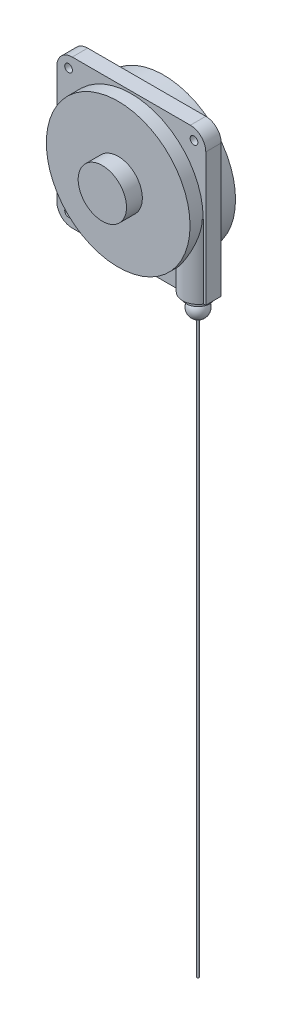
from build123d import *

# Parameters (mm, degrees)
SZKIC1_W                    = 193
SZKIC1_H                    = 192
DODANIE_WYCI_GNI_CIE1_DEPTH = 47.5
OTW_R_10_0_10_1_D           = 10
SZKIC5_R                    = 20
DODANIE_WYCI_GNI_CIE2_DEPTH = 95
ZAOKR_GLENIE1_R             = 20


with BuildPart() as part:
    # Szkic1 → Dodanie-wyciągnięcie1 (new, symmetric)
    with BuildSketch(Plane.XY):
        Rectangle(SZKIC1_W, SZKIC1_H)
    extrude(amount=DODANIE_WYCI_GNI_CIE1_DEPTH, both=True)

    # Szkic2 → Wycięcie-obrót1 (revolve, cut)
    with BuildSketch(Plane(origin=(0, 0, 0), x_dir=(1, 0, 0), z_dir=(0, 1, 0))):
        Polygon((-93.108465818, -10), (-93.108465818, -26.965533902), (-31.305449461, -26.965533902), (-31.305449461, -47.5), (-96.5, -47.5), (-149.784754378, -47.5), (-149.784754378, -10), align=None)
        Polygon((-93.108465818, 10), (-149.784754378, 10), (-149.784754378, 64.69075005), (-34.374339346, 64.69075005), (-34.374339346, 47.5), (-93.108465818, 31.958776917), align=None)
    revolve(axis=Axis((0, 0, 0), (0, 0, -1)), mode=Mode.SUBTRACT)

    # Otwór Ø10.0 (10)1 (through all)
    with Locations(Plane.XY.offset(10)):
        with Locations((-81.25, 81.25), (81.25, 81.25), (-81.25, -81.25)):
            Hole(OTW_R_10_0_10_1_D / 2)

    # Szkic5 → Dodanie-wyciągnięcie2 (add)
    with BuildSketch(Plane.XZ.offset(96)):
        with Locations((76.5, 0)):
            Circle(SZKIC5_R)
    extrude(amount=-DODANIE_WYCI_GNI_CIE2_DEPTH)

    # Zaokrąglenie1
    zaokr_glenie1_edges = [part.edges().sort_by_distance(p)[0] for p in [
        (-96.5, -96, 0),
        (-96.5, 96, 0),
        (96.5, 96, 0),
    ]]
    fillet(zaokr_glenie1_edges, radius=ZAOKR_GLENIE1_R)

    # Szkic6 → Obrót1 (revolve)
    with BuildSketch(Plane.XY):
        with BuildLine():
            Line((76.5, -96), (91.5, -96))
            Line((91.5, -96), (91.5, -102))
            Line((91.5, -102), (81.295831523, -102))
            ThreePointArc((81.295831523, -102), (88.377677323, -114.709029376), (78, -124.9058809))
            Line((78, -124.9058809), (78, -864.813984477))
            Line((78, -864.813984477), (76.5, -864.813984477))
            Line((76.5, -864.813984477), (76.5, -96))
        make_face()
    revolve(axis=Axis((76.5, -95.828898057, 0), (0, -1, 0)))


solid = part.part
